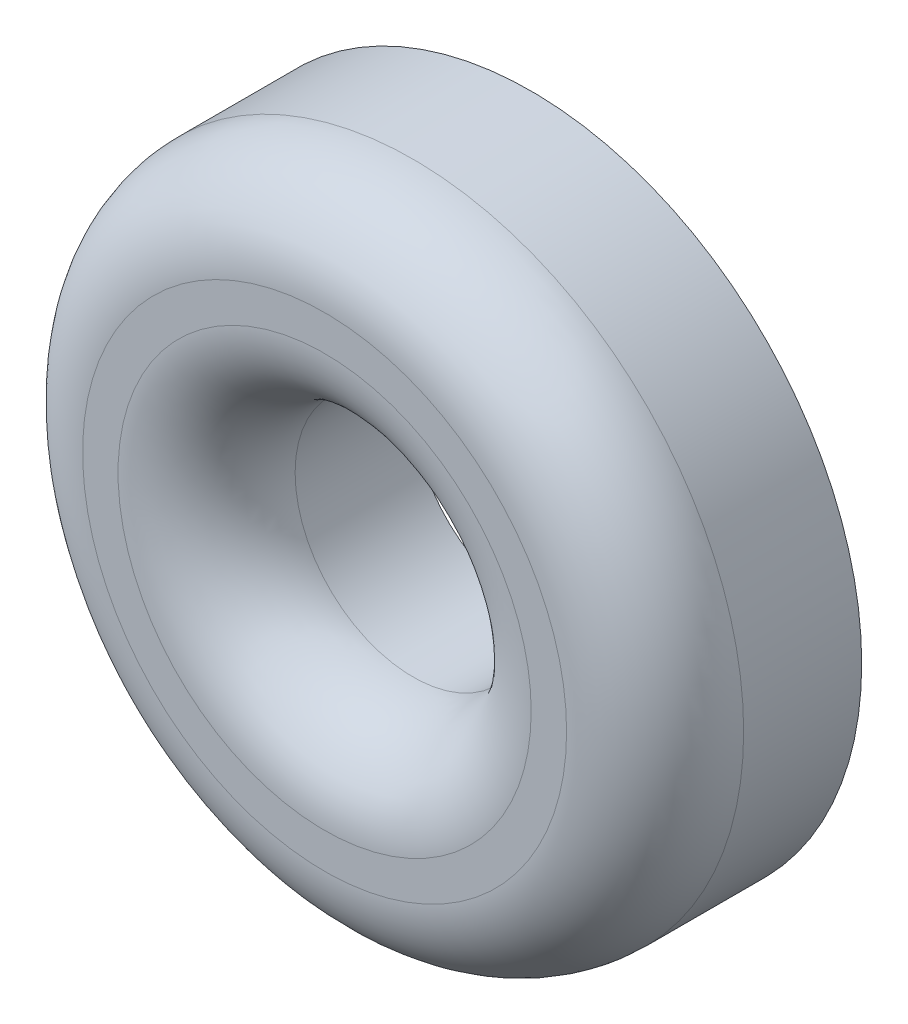
from build123d import *

# Parameters (mm, degrees)
SKETCH1_R           = 2.8
SKETCH1_R_2         = 1
BOSS_EXTRUDE1_DEPTH = 1.75
FILLET1_R           = 0.75


with BuildPart() as part:
    # Sketch1 → Boss-Extrude1 (new body)
    with BuildSketch(Plane.XY):
        Circle(SKETCH1_R)
        Circle(SKETCH1_R_2, mode=Mode.SUBTRACT)
    extrude(amount=BOSS_EXTRUDE1_DEPTH)

    # Fillet1
    fillet1_edges = [part.edges().sort_by_distance(p)[0] for p in [
        (-2.8, 0, 1.75),
        (-1, 0, 1.75),
    ]]
    fillet(fillet1_edges, radius=FILLET1_R)


solid = part.part
